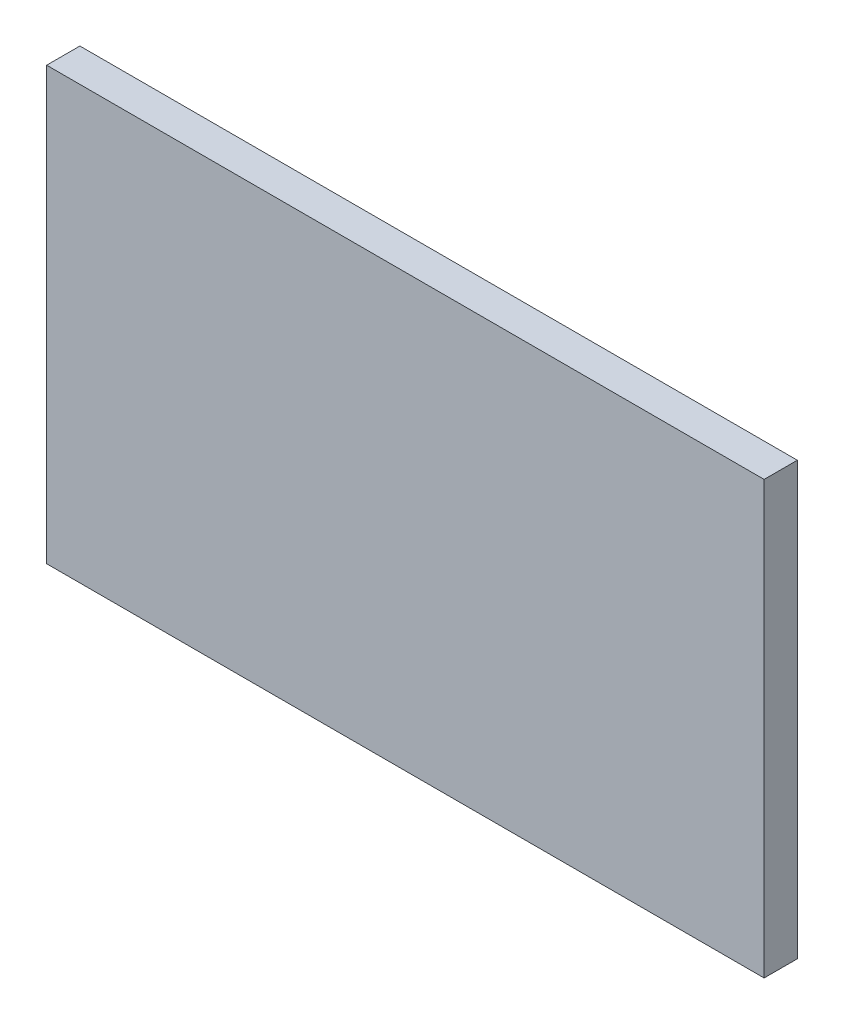
from build123d import *

# Parameters (mm, degrees)
SKETCH1_W           = 108
SKETCH1_H           = 65
BOSS_EXTRUDE1_DEPTH = 5


with BuildPart() as part:
    # Sketch1 → Boss-Extrude1 (new body)
    with BuildSketch(Plane.XY):
        with Locations((3.885856079, 0.328784119)):
            Rectangle(SKETCH1_W, SKETCH1_H)
    extrude(amount=BOSS_EXTRUDE1_DEPTH)


solid = part.part
